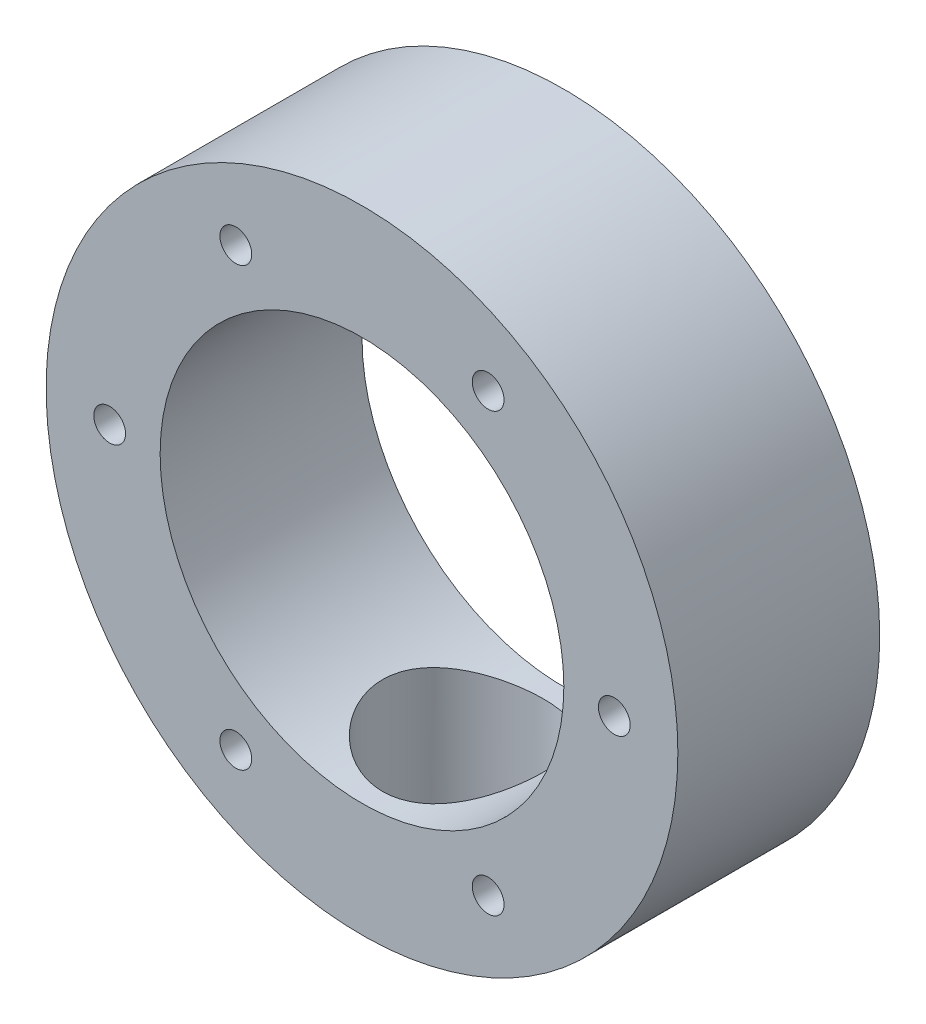
from build123d import *

# Parameters (mm, degrees)
SKETCH1_R                      = 9.9375
SKETCH1_R_2                    = 6.35
SKETCH1_R_3                    = 0.5
BOSS_EXTRUDE1_DEPTH            = 6.35
F_8_0_199_DIAMETER_HOLE1_D     = 5.0546
F_8_0_199_DIAMETER_HOLE1_DEPTH = 8.35
F_8_0_199_DIAMETER_HOLE1_TIP   = 1.518555042


with BuildPart() as part:
    # Sketch1 → Boss-Extrude1 (new body)
    with BuildSketch(Plane.XY):
        Circle(SKETCH1_R)
        Circle(SKETCH1_R_2, mode=Mode.SUBTRACT)
        with Locations((-7.9375, 0)):
            Circle(SKETCH1_R_3, mode=Mode.SUBTRACT)
        with Locations((-3.96875, 6.874076643)):
            Circle(SKETCH1_R_3, mode=Mode.SUBTRACT)
        with Locations((3.96875, 6.874076643)):
            Circle(SKETCH1_R_3, mode=Mode.SUBTRACT)
        with Locations((7.9375, 0)):
            Circle(SKETCH1_R_3, mode=Mode.SUBTRACT)
        with Locations((3.96875, -6.874076643)):
            Circle(SKETCH1_R_3, mode=Mode.SUBTRACT)
        with Locations((-3.96875, -6.874076643)):
            Circle(SKETCH1_R_3, mode=Mode.SUBTRACT)
    extrude(amount=BOSS_EXTRUDE1_DEPTH)

    # #8 (0.199) Diameter Hole1
    with Locations(Plane.XZ.offset(9.9375)):
        with Locations((0, 3.175)):
            Hole(F_8_0_199_DIAMETER_HOLE1_D / 2, depth=F_8_0_199_DIAMETER_HOLE1_DEPTH)
            with Locations((0, 0, -(F_8_0_199_DIAMETER_HOLE1_DEPTH + F_8_0_199_DIAMETER_HOLE1_TIP / 2))):  # 118° drill point
                Cone(0, F_8_0_199_DIAMETER_HOLE1_D / 2, F_8_0_199_DIAMETER_HOLE1_TIP, mode=Mode.SUBTRACT)


solid = part.part
